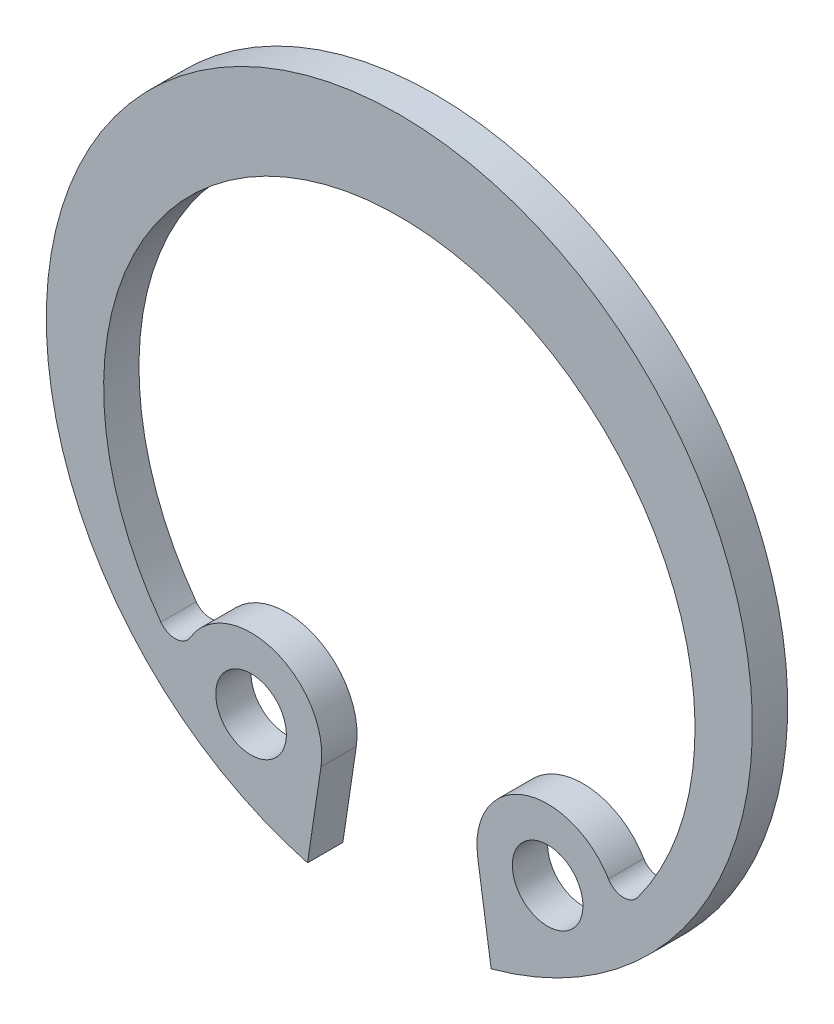
from build123d import *

# Parameters (mm, degrees)
SKETCH1_R           = 1
BOSS_EXTRUDE1_DEPTH = 1


with BuildPart() as part:
    # Sketch1 → Boss-Extrude1 (new body)
    with BuildSketch(Plane.XY):
        with BuildLine():
            Line((-2.219205601, -7.108131345), (-2.6, -9.656086164))
            ThreePointArc((-2.6, -9.656086164), (0, 10), (2.6, -9.656086164))
            Line((2.6, -9.656086164), (2.219205601, -7.108131345))
            ThreePointArc((2.219205601, -7.108131345), (3.527070168, -4.925741596), (5.920924078, -5.787599008))
            ThreePointArc((5.920924078, -5.787599008), (6.326626004, -6.031258149), (6.753764885, -5.82750289))
            ThreePointArc((6.753764885, -5.82750289), (0, 7.5), (-6.753764885, -5.82750289))
            ThreePointArc((-6.753764885, -5.82750289), (-6.326626004, -6.031258149), (-5.920924078, -5.787599008))
            ThreePointArc((-5.920924078, -5.787599008), (-3.527070168, -4.925741596), (-2.219205601, -7.108131345))
        make_face()
        with Locations((-4.2, -6.812099638)):
            Circle(SKETCH1_R, mode=Mode.SUBTRACT)
        with Locations((4.2, -6.812099638)):
            Circle(SKETCH1_R, mode=Mode.SUBTRACT)
    extrude(amount=BOSS_EXTRUDE1_DEPTH)


solid = part.part
